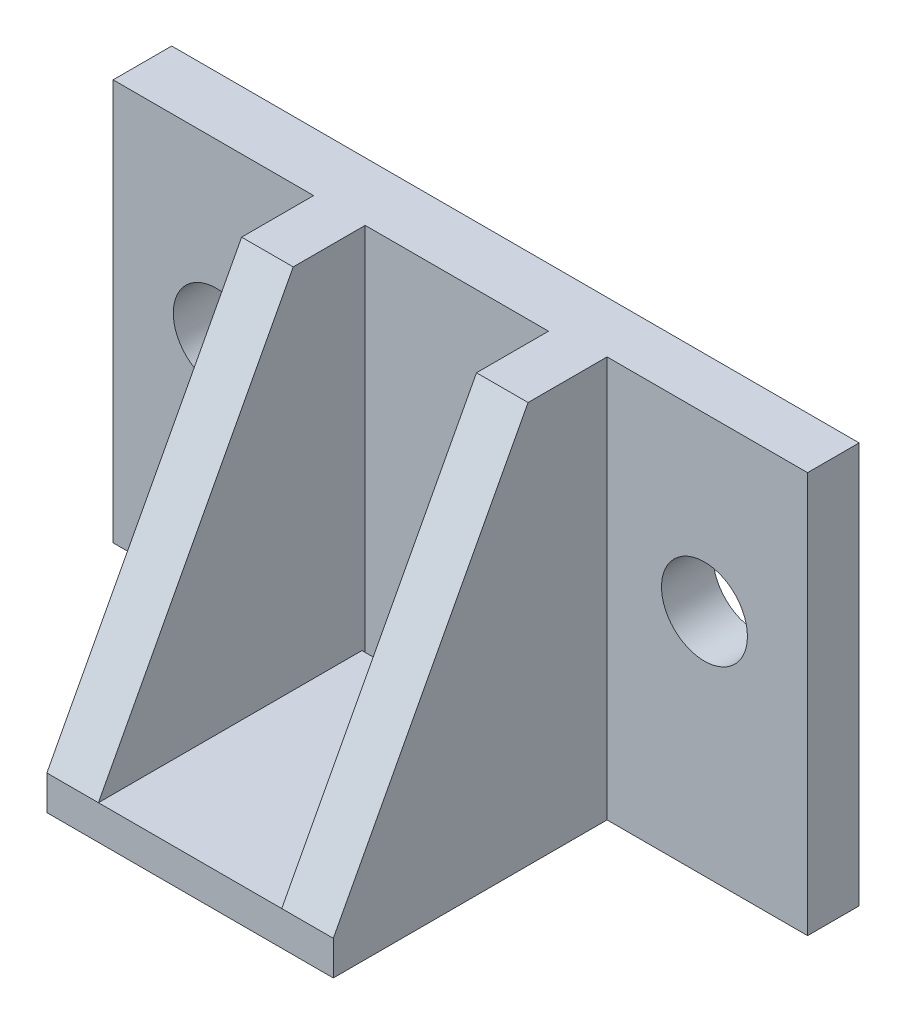
from build123d import *

# Parameters (mm, degrees)
BOSS_EXTRUDE1_DEPTH = 70
SKETCH2_R           = 7.5
CUT_EXTRUDE1_DEPTH  = 9
SKETCH3_R           = 7.5
CUT_EXTRUDE2_DEPTH  = 9
BOSS_EXTRUDE7_DEPTH = 9
BOSS_EXTRUDE8_DEPTH = 9
SKETCH8_W           = 32
SKETCH8_H           = 6
BOSS_EXTRUDE9_DEPTH = 46
SKETCH10_R          = 7.5
CUT_EXTRUDE3_DEPTH  = 46


with BuildPart() as part:
    # Sketch1 → Boss-Extrude1 (new body)
    with BuildSketch(Plane(origin=(0, 0, 0), x_dir=(1, 0, 0), z_dir=(0, 1, 0))):
        Polygon((0, 0), (120, 0), (120, -9), (85, -9), (85, -22.792607803), (76, -22.792607803), (76, -10.22587269), (44, -10.22587269), (44, -22.792607803), (35, -22.792607803), (35, -10.22587269), (0, -10.22587269), align=None)
    extrude(amount=BOSS_EXTRUDE1_DEPTH)

    # Sketch2 → Cut-Extrude1 (cut)
    with BuildSketch(Plane.XY.offset(9)):
        with Locations((102, 40)):
            Circle(SKETCH2_R)
    extrude(amount=-CUT_EXTRUDE1_DEPTH, mode=Mode.SUBTRACT)

    # Sketch3 → Cut-Extrude2 (cut)
    with BuildSketch(Plane.XY.offset(10.22587269)):
        with Locations((18, 40)):
            Circle(SKETCH3_R)
    extrude(amount=-CUT_EXTRUDE2_DEPTH, mode=Mode.SUBTRACT)

    # Sketch4 → Boss-Extrude7 (add)
    with BuildSketch(Plane(origin=(85, 0, 0), x_dir=(0, 0, -1), z_dir=(1, 0, 0))):
        Polygon((-56.792607803, 0), (-22.792607803, 0), (-22.792607803, 70), (-56.792607803, 6), align=None)
    extrude(amount=-BOSS_EXTRUDE7_DEPTH)

    # Sketch7 → Boss-Extrude8 (add)
    with BuildSketch(Plane.ZY.offset(-35)):
        Polygon((22.792607803, 0), (56.792607803, 0), (56.792607803, 6), (22.792607803, 70), align=None)
    extrude(amount=-BOSS_EXTRUDE8_DEPTH)

    # Sketch8 → Boss-Extrude9 (add)
    with BuildSketch(Plane.XY.offset(56.792607803)):
        with Locations((60, 3)):
            Rectangle(SKETCH8_W, SKETCH8_H)
    extrude(amount=-BOSS_EXTRUDE9_DEPTH)

    # Sketch10 → Cut-Extrude3 (cut)
    with BuildSketch(Plane.XY.offset(1.22587269)):
        with Locations((18, 40)):
            Circle(SKETCH10_R)
    extrude(amount=-CUT_EXTRUDE3_DEPTH, mode=Mode.SUBTRACT)


solid = part.part
